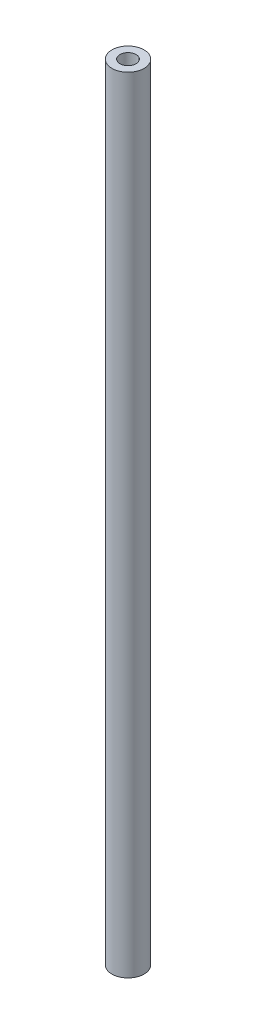
from build123d import *

# Parameters (mm, degrees)
SKETCH_1_R      = 10
SKETCH_1_R_2    = 5
EXTRUDE_1_DEPTH = 488


with BuildPart() as part:
    # Эскиз1 → Бобышка-Вытянуть1 (new body)
    with BuildSketch(Plane(origin=(0, 0, 0), x_dir=(1, 0, 0), z_dir=(0, 1, 0))):
        with Locations(Location((0, 0, 0), (0, 0, 90))):
            Circle(SKETCH_1_R)
        with Locations(Location((0, 0, 0), (0, 0, 90))):
            Circle(SKETCH_1_R_2, mode=Mode.SUBTRACT)
    extrude(amount=EXTRUDE_1_DEPTH)


solid = part.part
